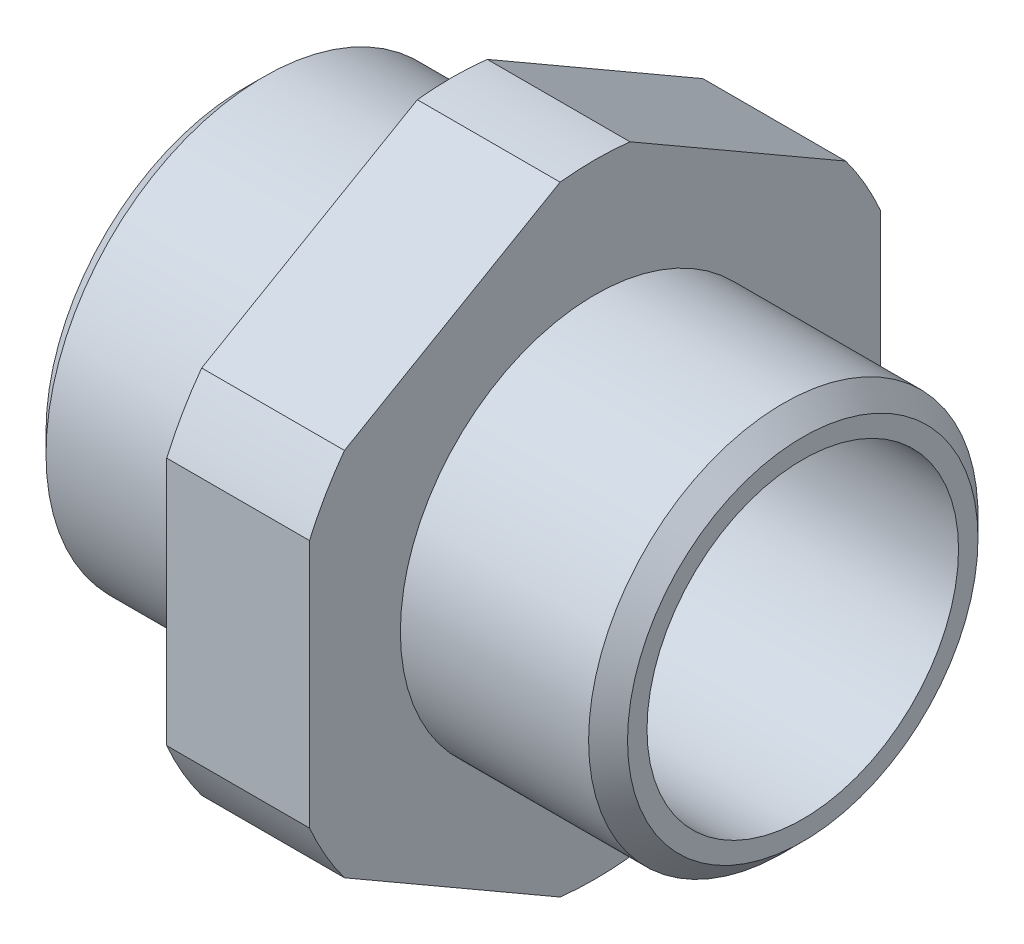
from build123d import *

# Parameters (mm, degrees)
SKETCH_2_R               = 7.5
EXTRUDE_1_DEPTH          = 8
SKETCH_3_R               = 7.5
EXTRUDE_2_DEPTH          = 5.5
SKETCH_4_R               = 8.4
EXTRUDE_3_DEPTH          = 8
SKETCH_6_R               = 12.701705922
SKETCH_6_R_2             = 12
CUT_EXTRUDE_1_DEPTH      = 22.554195261
CHAMFER_1_SIZE           = 0.75
EXTRUDE_4_REACH          = 22.224
SKETCH_7_W               = 1
SKETCH_7_H               = 6.5
SKETCH_8_R               = 5
CUT_EXTRUDE_2_DEPTH      = 27.96757312
SKETCH_9_R               = 6.5
CUT_EXTRUDE_3_DEPTH      = 6.5
PATTERN_CIRCULAR_1_COUNT = 6


with BuildPart() as part:
    # Эскиз2 → Вытянуть1 (new body)
    with BuildSketch(Plane(origin=(0, 0, 0), x_dir=(0, 0, -1), z_dir=(1, 0, 0))):
        Circle(SKETCH_2_R)
    extrude(amount=-EXTRUDE_1_DEPTH)

    # Эскиз3 → Вытянуть2 (add)
    # profile 1 of 2: a face of its own
    with BuildSketch(Plane.ZY.offset(8)):
        Polygon((11, -6.350852961), (11, 6.350852961), (0, 12.701705922), (-11, 6.350852961), (-11, -6.350852961), (0, -12.701705922), align=None)
        with Locations(Location((0, 0, 0), (0, 0, 180))):
            Circle(SKETCH_3_R, mode=Mode.SUBTRACT)
    # profile 2 of 2: a face of its own
    with BuildSketch(Plane.ZY.offset(8)):
        with Locations(Location((0, 0, 0), (0, 0, 180))):
            Circle(SKETCH_3_R)
    extrude(amount=EXTRUDE_2_DEPTH)

    # Эскиз4 → Вытянуть3 (add)
    with BuildSketch(Plane.ZY.offset(13.5)):
        Circle(SKETCH_4_R)
    extrude(amount=EXTRUDE_3_DEPTH)

    # Эскиз5 → Вырез-Повернуть1 (revolve, cut)
    with BuildSketch(Plane.XY, mode=Mode.PRIVATE) as cut_revolve_1_sk:
        Polygon((0, 0), (0, 6), (-12, 6), (-12, 5), (-13.5, 5), (-15, 6.5), (-21.5, 6.5), (-21.5, 0), align=None)
    revolve(cut_revolve_1_sk.sketch.rotate(Axis((-21.5, 0, 0), (1, 0, 0)), 90), axis=Axis((-21.5, 0, 0), (1, 0, 0)), mode=Mode.SUBTRACT)

    # Эскиз6 → Вырез-Вытянуть1 (cut, through all)
    with BuildSketch(Plane.ZY.offset(13.5)):
        Circle(SKETCH_6_R)
        Circle(SKETCH_6_R_2, mode=Mode.SUBTRACT)
    extrude(amount=-CUT_EXTRUDE_1_DEPTH, mode=Mode.SUBTRACT)

    # Фаска1
    chamfer_1_edges = [part.edges().sort_by_distance(p)[0] for p in [
        (0, 0, 7.5),
        (-21.5, 0, -8.4),
    ]]
    chamfer(chamfer_1_edges, length=CHAMFER_1_SIZE)

    # Вытянуть4: up to this face of the body (flat: up to its plane)
    extrude_4_end = Plane(part.part.faces().sort_by_distance((-21.5, 0, -7.433625325))[0])
    # Эскиз7 → Вытянуть4 (add, up to the picked face)
    with BuildSketch(Plane(origin=(-12, 0, 0), x_dir=(0, 0, -1), z_dir=(1, 0, 0)), mode=Mode.PRIVATE) as extrude_4_sk1:
        with Locations((0, 3.25)):
            Rectangle(SKETCH_7_W, SKETCH_7_H)
    extrude_4_tool1 = split(extrude(extrude_4_sk1.sketch, amount=-EXTRUDE_4_REACH, mode=Mode.PRIVATE), bisect_by=extrude_4_end, keep=Keep.BOTH, mode=Mode.PRIVATE)
    add(extrude_4_tool1.solids().sort_by(Axis((-12, 3.25, 0), (-1, 0, 0)))[0])

    # Эскиз8 → Вырез-Вытянуть2 (cut, through all)
    with BuildSketch(Plane.ZY.offset(21.5)):
        Circle(SKETCH_8_R)
    extrude(amount=-CUT_EXTRUDE_2_DEPTH, mode=Mode.SUBTRACT)

    # Эскиз9 → Вырез-Вытянуть3 (cut)
    with BuildSketch(Plane.ZY.offset(21.5)):
        Circle(SKETCH_9_R)
    extrude(amount=-CUT_EXTRUDE_3_DEPTH, mode=Mode.SUBTRACT)

    # Круговой массив1: part ×6 about axis
    pattern_circular_1_axis = Axis((0, 0, 0), (1, 0, 0))


with BuildPart() as part_1:
    add(part.part)
    for i in range(1, PATTERN_CIRCULAR_1_COUNT):
        add(part.part.rotate(pattern_circular_1_axis, i * 360 / PATTERN_CIRCULAR_1_COUNT))


solid = part_1.part
